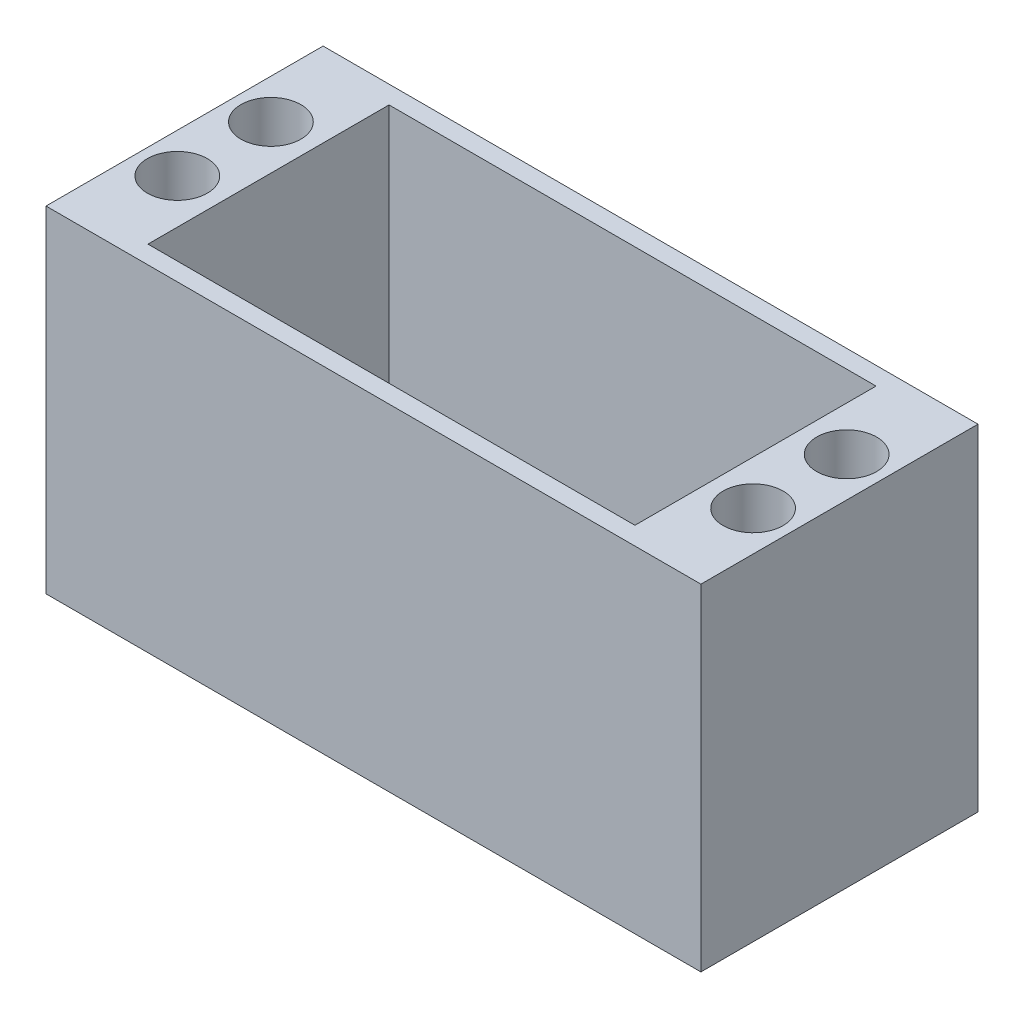
from build123d import *

# Parameters (mm, degrees)
SKETCH2_W           = 54.6
SKETCH2_H           = 23.1
SKETCH2_W_2         = 40.6
SKETCH2_H_2         = 20.1
BOSS_EXTRUDE2_DEPTH = 28
SKETCH3_R           = 2.5
CUT_EXTRUDE1_DEPTH  = 41.776126594


with BuildPart() as part:
    # Sketch2 → Boss-Extrude2 (new body)
    with BuildSketch(Plane(origin=(0, 0, 0), x_dir=(1, 0, 0), z_dir=(0, 1, 0))):
        Rectangle(SKETCH2_W, SKETCH2_H)
        Rectangle(SKETCH2_W_2, SKETCH2_H_2, mode=Mode.SUBTRACT)
    extrude(amount=BOSS_EXTRUDE2_DEPTH)

    # Sketch3 → Cut-Extrude1 (cut, through all)
    with BuildSketch(Plane(origin=(0, 28, 0), x_dir=(1, 0, 0), z_dir=(0, 1, 0))):
        with Locations(Location((-24, 3.9, 0), (0, 0, 270))):
            Circle(SKETCH3_R)
        with Locations(Location((24, 3.9, 0), (0, 0, 270))):
            Circle(SKETCH3_R)
        with Locations(Location((24, -3.9, 0), (0, 0, 270))):
            Circle(SKETCH3_R)
        with Locations(Location((-24, -3.9, 0), (0, 0, 270))):
            Circle(SKETCH3_R)
    extrude(amount=-CUT_EXTRUDE1_DEPTH, mode=Mode.SUBTRACT)


solid = part.part
